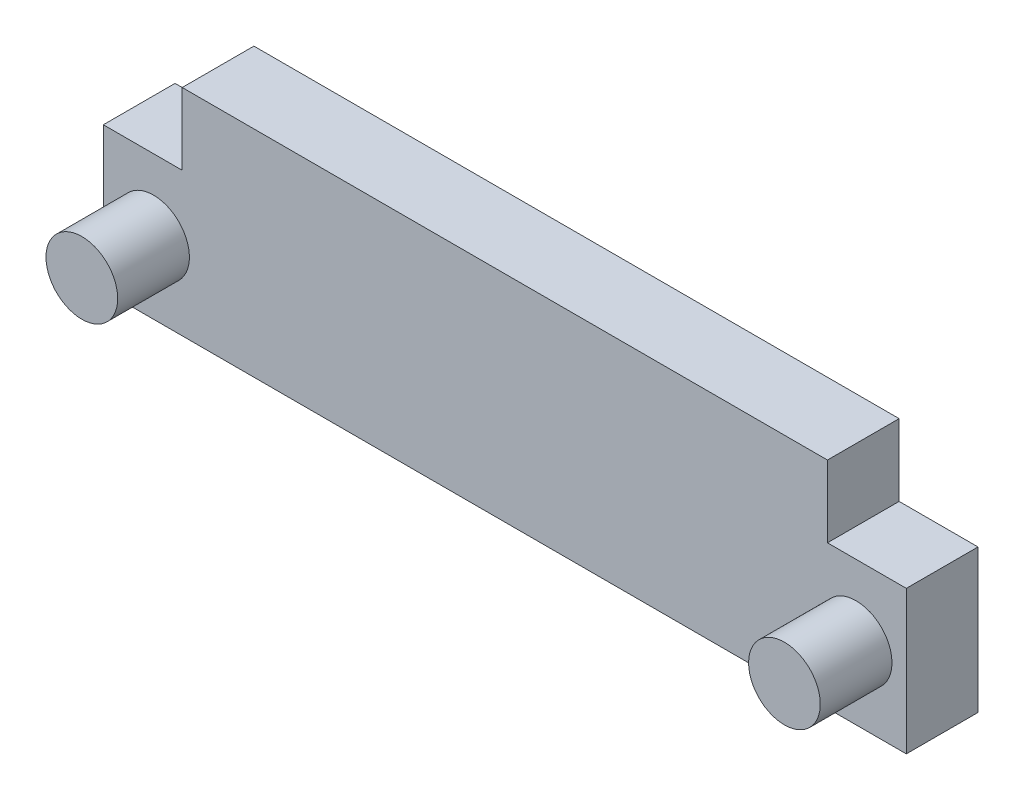
from build123d import *

# Parameters (mm, degrees)
SKETCH1_W           = 90
SKETCH1_H           = 30
BOSS_EXTRUDE1_DEPTH = 10
SKETCH3_W           = 10
SKETCH3_H           = 20
BOSS_EXTRUDE2_DEPTH = 11
SKETCH4_R           = 5
BOSS_EXTRUDE3_DEPTH = 10


with BuildPart() as part:
    # Sketch1 → Boss-Extrude1 (new body)
    with BuildSketch(Plane.XY):
        Rectangle(SKETCH1_W, SKETCH1_H)
    extrude(amount=BOSS_EXTRUDE1_DEPTH)

    # Sketch3 → Boss-Extrude2 (add)
    with BuildSketch(Plane(origin=(45, 0, 0), x_dir=(0, 0, -1), z_dir=(1, 0, 0))):
        with Locations((-5, -5)):
            Rectangle(SKETCH3_W, SKETCH3_H)
    boss_extrude2 = extrude(amount=BOSS_EXTRUDE2_DEPTH)

    # Mirror1: Boss-Extrude2 across plane
    add(boss_extrude2.mirror(Plane(origin=(0, 0, 0), x_dir=(0, 0, 1), z_dir=(1, 0, 0))))

    # Sketch4 → Boss-Extrude3 (add)
    with BuildSketch(Plane.XY.offset(10)):
        with Locations(Location((-49, -5, 0), (0, 0, 180))):
            Circle(SKETCH4_R)
    boss_extrude3 = extrude(amount=BOSS_EXTRUDE3_DEPTH)

    # Mirror2: Boss-Extrude3 across plane
    add(boss_extrude3.mirror(Plane(origin=(0, 0, 0), x_dir=(0, 0, 1), z_dir=(1, 0, 0))))


solid = part.part
